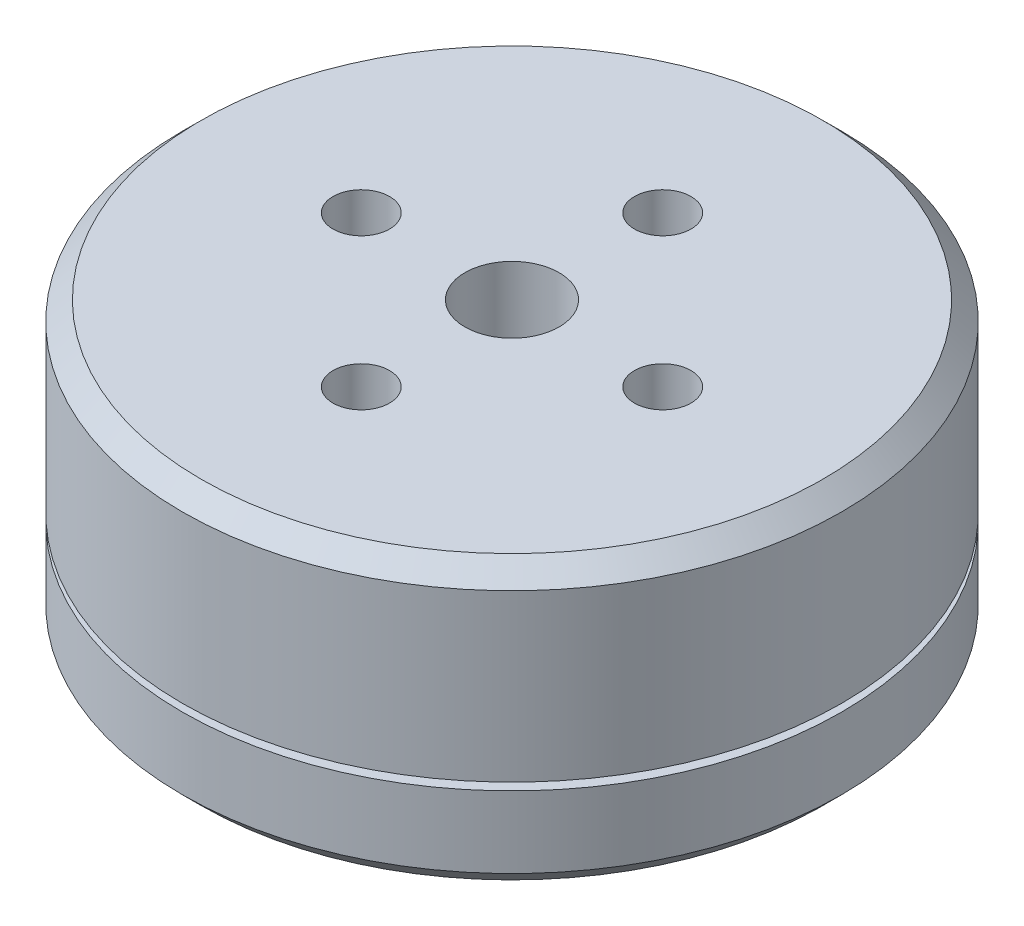
from build123d import *

# Parameters (mm, degrees)
SKETCH1_R               = 17.5
BOSS_EXTRUDE1_DEPTH     = 15
SKETCH2_R               = 1.5
CUT_EXTRUDE1_DEPTH      = 3
CUT_EXTRUDE2_START      = -3
SKETCH3_R               = 1.5
CUT_EXTRUDE2_DEPTH      = 3
CUT_EXTRUDE3_DEPTH      = 0.2
CUT_EXTRUDE3_DEPTH_BACK = 0.2
SKETCH4_R               = 17.5
SKETCH4_R_2             = 16.5
CHAMFER1_SIZE           = 1
SKETCH5_R               = 2.5
CUT_EXTRUDE4_DEPTH      = 29.939592257


with BuildPart() as part:
    # Sketch1 → Boss-Extrude1 (new body)
    with BuildSketch(Plane(origin=(0, 0, 0), x_dir=(1, 0, 0), z_dir=(0, 1, 0))):
        with Locations(Location((0, 0, 0), (0, 0, 270))):
            Circle(SKETCH1_R)
    extrude(amount=BOSS_EXTRUDE1_DEPTH)

    # Sketch2 → Cut-Extrude1 (cut)
    with BuildSketch(Plane(origin=(0, 15, 0), x_dir=(1, 0, 0), z_dir=(0, 1, 0))):
        with Locations(Location((-8, 0, 0), (0, 0, 270))):
            Circle(SKETCH2_R)
        with Locations(Location((8, 0, 0), (0, 0, 270))):
            Circle(SKETCH2_R)
        with Locations(Location((0, 8, 0), (0, 0, 270))):
            Circle(SKETCH2_R)
        with Locations(Location((0, -8, 0), (0, 0, 270))):
            Circle(SKETCH2_R)
    extrude(amount=-CUT_EXTRUDE1_DEPTH, mode=Mode.SUBTRACT)

    # Sketch3 → Cut-Extrude2 (cut)
    with BuildSketch(Plane.XZ.offset(CUT_EXTRUDE2_START)):
        with Locations(Location((0, 9.5, 0), (0, 0, 270))):
            Circle(SKETCH3_R)
        with Locations(Location((0, -9.5, 0), (0, 0, 270))):
            Circle(SKETCH3_R)
        with Locations(Location((8, 0, 0), (0, 0, 90))):
            Circle(SKETCH3_R)
        with Locations(Location((-8, 0, 0), (0, 0, 90))):
            Circle(SKETCH3_R)
    extrude(amount=CUT_EXTRUDE2_DEPTH, mode=Mode.SUBTRACT)

    # Sketch4 → Cut-Extrude3 (cut, two sides: drawn at the far end of the back side and taken through both)
    with BuildSketch(Plane(origin=(0, 5, 0), x_dir=(-1, 0, 0), z_dir=(0, -1, 0)).offset(-CUT_EXTRUDE3_DEPTH_BACK)):
        with Locations(Location((0, 0, 0), (0, 0, 90))):
            Circle(SKETCH4_R)
        with Locations(Location((0, 0, 0), (0, 0, 90))):
            Circle(SKETCH4_R_2, mode=Mode.SUBTRACT)
    extrude(amount=CUT_EXTRUDE3_DEPTH + CUT_EXTRUDE3_DEPTH_BACK, mode=Mode.SUBTRACT)

    # Chamfer1
    chamfer1_edges = [part.edges().sort_by_distance(p)[0] for p in [
        (0, 0, -17.5),
        (0, 15, -17.5),
    ]]
    chamfer(chamfer1_edges, length=CHAMFER1_SIZE)

    # Sketch5 → Cut-Extrude4 (cut, through all)
    with BuildSketch(Plane(origin=(0, 15, 0), x_dir=(1, 0, 0), z_dir=(0, 1, 0))):
        with Locations(Location((0, 0, 0), (0, 0, 270))):
            Circle(SKETCH5_R)
    extrude(amount=-CUT_EXTRUDE4_DEPTH, mode=Mode.SUBTRACT)


solid = part.part
